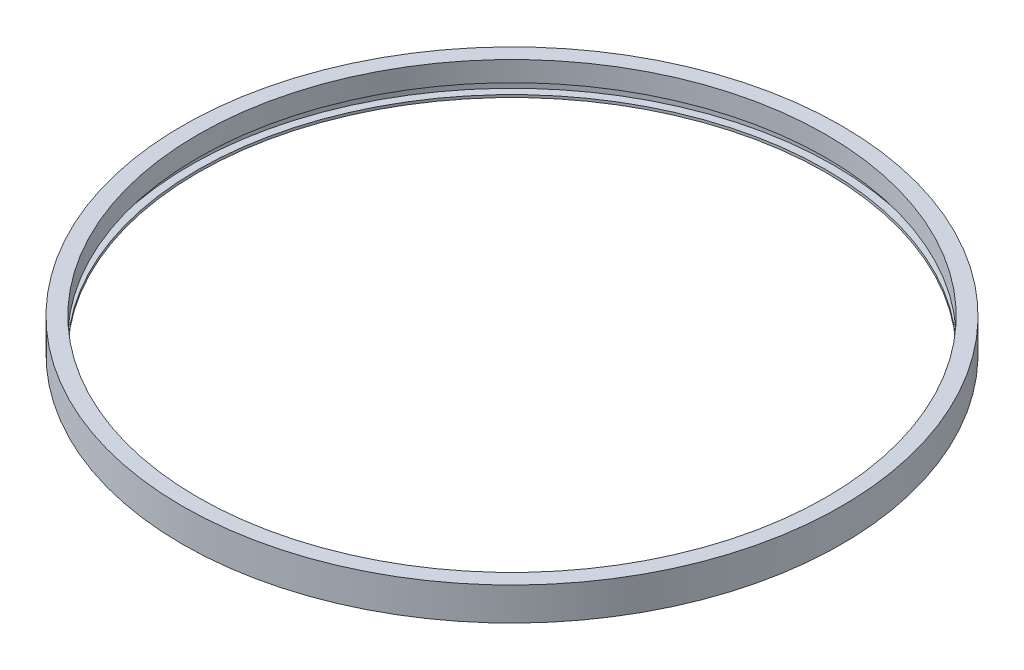
from build123d import *

# Parameters (mm, degrees)
CROQUIS1_R              = 64
CROQUIS1_R_2            = 61
SALIENTE_EXTRUIR1_DEPTH = 3.9
SALIENTE_EXTRUIR2_START = 2
CROQUIS2_R              = 64
CROQUIS2_R_2            = 62.5
SALIENTE_EXTRUIR2_DEPTH = 2
SALIENTE_EXTRUIR3_START = 0.5
CROQUIS3_R              = 64
CROQUIS3_R_2            = 61
SALIENTE_EXTRUIR3_DEPTH = 0.5


with BuildPart() as part:
    # Croquis1 → Saliente-Extruir1 (new body)
    with BuildSketch(Plane(origin=(0, 0, 0), x_dir=(1, 0, 0), z_dir=(0, 1, 0))):
        with Locations(Location((0, 0, 0), (0, 0, 270))):
            Circle(CROQUIS1_R)
        with Locations(Location((0, 0, 0), (0, 0, 270))):
            Circle(CROQUIS1_R_2, mode=Mode.SUBTRACT)
    extrude(amount=SALIENTE_EXTRUIR1_DEPTH)

    # Croquis2 → Saliente-Extruir2 (add)
    with BuildSketch(Plane.XZ.offset(SALIENTE_EXTRUIR2_START)):
        with Locations(Location((0, 0, 0), (0, 0, 270))):
            Circle(CROQUIS2_R)
        with Locations(Location((0, 0, 0), (0, 0, 270))):
            Circle(CROQUIS2_R_2, mode=Mode.SUBTRACT)
    extrude(amount=-SALIENTE_EXTRUIR2_DEPTH)

    # Croquis3 → Saliente-Extruir3 (add)
    with BuildSketch(Plane.XZ.offset(2).offset(SALIENTE_EXTRUIR3_START)):
        with Locations(Location((0, 0, 0), (0, 0, 270))):
            Circle(CROQUIS3_R)
        with Locations(Location((0, 0, 0), (0, 0, 90))):
            Circle(CROQUIS3_R_2, mode=Mode.SUBTRACT)
    extrude(amount=-SALIENTE_EXTRUIR3_DEPTH)


solid = part.part
